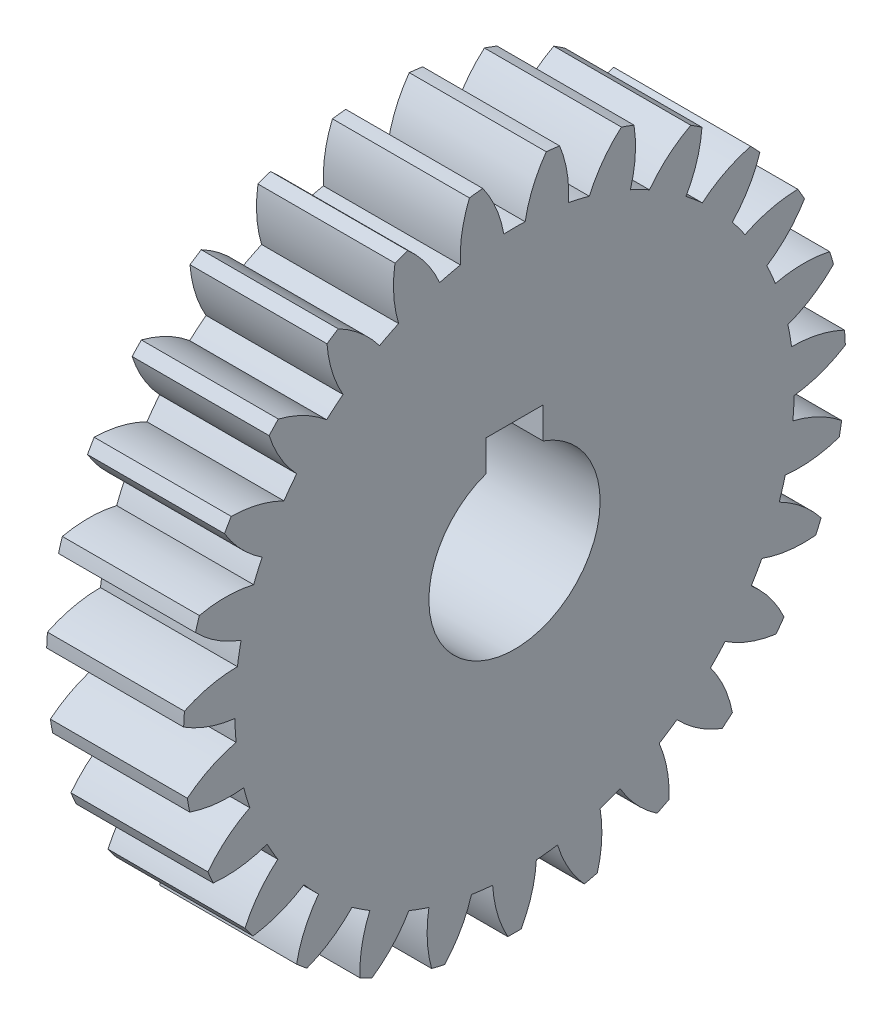
from build123d import *

# Parameters (mm, degrees)
BASPROSKE_W     = 12
BASPROSKE_H     = 29
TOOTHCUT_DEPTH  = 43.731721238
TEETHCUTS_COUNT = 27
TEETHCUTS_ANGLE = 346.666666667
BORSKE_R        = 7.5
BORE_DEPTH      = 50.0000508
KEYSKE_W        = 5
KEYSKE_H        = 9.8
KEYWAY_DEPTH    = 50.0000508


with BuildPart() as part:
    # BasProSke → Base-Revolve (revolve)
    with BuildSketch(Plane(origin=(0, 0, 0), x_dir=(1, 0, 0), z_dir=(0, 1, 0)), mode=Mode.PRIVATE) as base_revolve_sk:
        with Locations((6, 14.5)):
            Rectangle(BASPROSKE_W, BASPROSKE_H)
    revolve(base_revolve_sk.sketch.rotate(Axis((-10, 0, 0), (1, 0, 0)), 180), axis=Axis((-10, 0, 0), (1, 0, 0)))

    # TooCutSke → ToothCut (cut, through all)
    with BuildSketch(Plane(origin=(0, 0, 0), x_dir=(0, 0, -1), z_dir=(1, 0, 0))):
        with BuildLine():
            ThreePointArc((0.93398677, 24.48119012), (0, 24.499), (-0.93398677, 24.48119012))
            ThreePointArc((-0.93398677, 24.48119012), (-1.619264734, 26.790298527), (-2.799272507, 28.890100702))
            ThreePointArc((-2.799272507, 28.890100702), (0, 29.0254), (2.799272507, 28.890100702))
            ThreePointArc((2.799272507, 28.890100702), (1.619264734, 26.790298527), (0.93398677, 24.48119012))
        make_face()
    toothcut = extrude(amount=TOOTHCUT_DEPTH, mode=Mode.SUBTRACT)

    # TeethCuts: ToothCut ×27 about axis
    teethcuts_axis = Axis((-10, 0, 0), (1, 0, 0))
    for i in range(1, TEETHCUTS_COUNT):
        add(toothcut.rotate(teethcuts_axis, i * TEETHCUTS_ANGLE / (TEETHCUTS_COUNT - 1)), mode=Mode.SUBTRACT)

    # BorSke → Bore (cut, symmetric)
    with BuildSketch(Plane(origin=(0, 0, 0), x_dir=(0, 0, -1), z_dir=(1, 0, 0))):
        with Locations(Location((0, 0, 0), (0, 0, 180))):
            Circle(BORSKE_R)
    extrude(amount=BORE_DEPTH, both=True, mode=Mode.SUBTRACT)

    # KeySke → Keyway (cut, symmetric)
    with BuildSketch(Plane(origin=(0, 0, 0), x_dir=(0, 0, -1), z_dir=(1, 0, 0))):
        with Locations((0, 4.9)):
            Rectangle(KEYSKE_W, KEYSKE_H)
    extrude(amount=KEYWAY_DEPTH, both=True, mode=Mode.SUBTRACT)


solid = part.part
